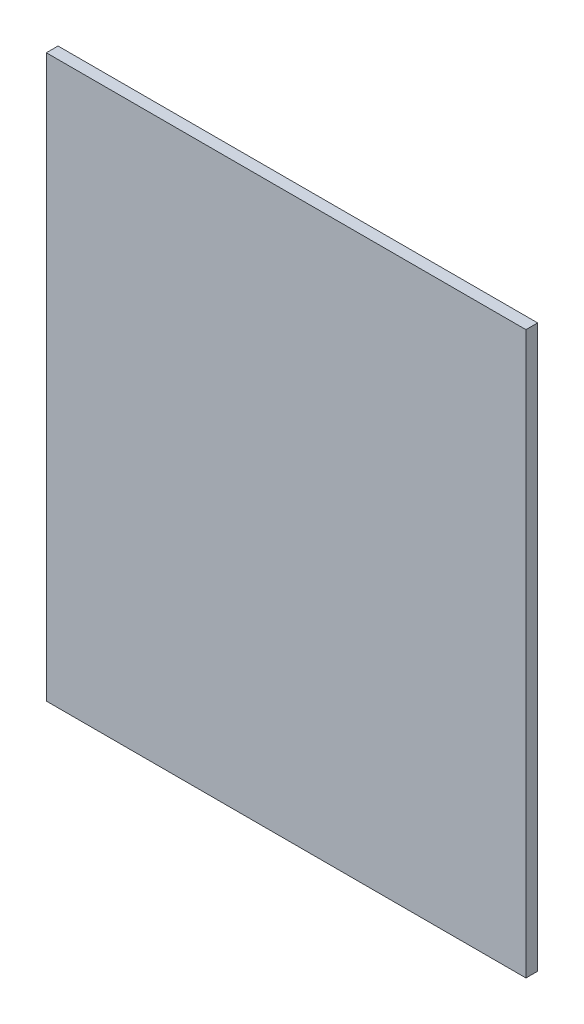
from build123d import *

# Parameters (mm, degrees)
SKETCH1_W           = 260.35
SKETCH1_H           = 304.8
BOSS_EXTRUDE1_DEPTH = 6.35


with BuildPart() as part:
    # Sketch1 → Boss-Extrude1 (new body)
    with BuildSketch(Plane.XY):
        with Locations((111.125, -133.35)):
            Rectangle(SKETCH1_W, SKETCH1_H)
    extrude(amount=BOSS_EXTRUDE1_DEPTH)


solid = part.part
